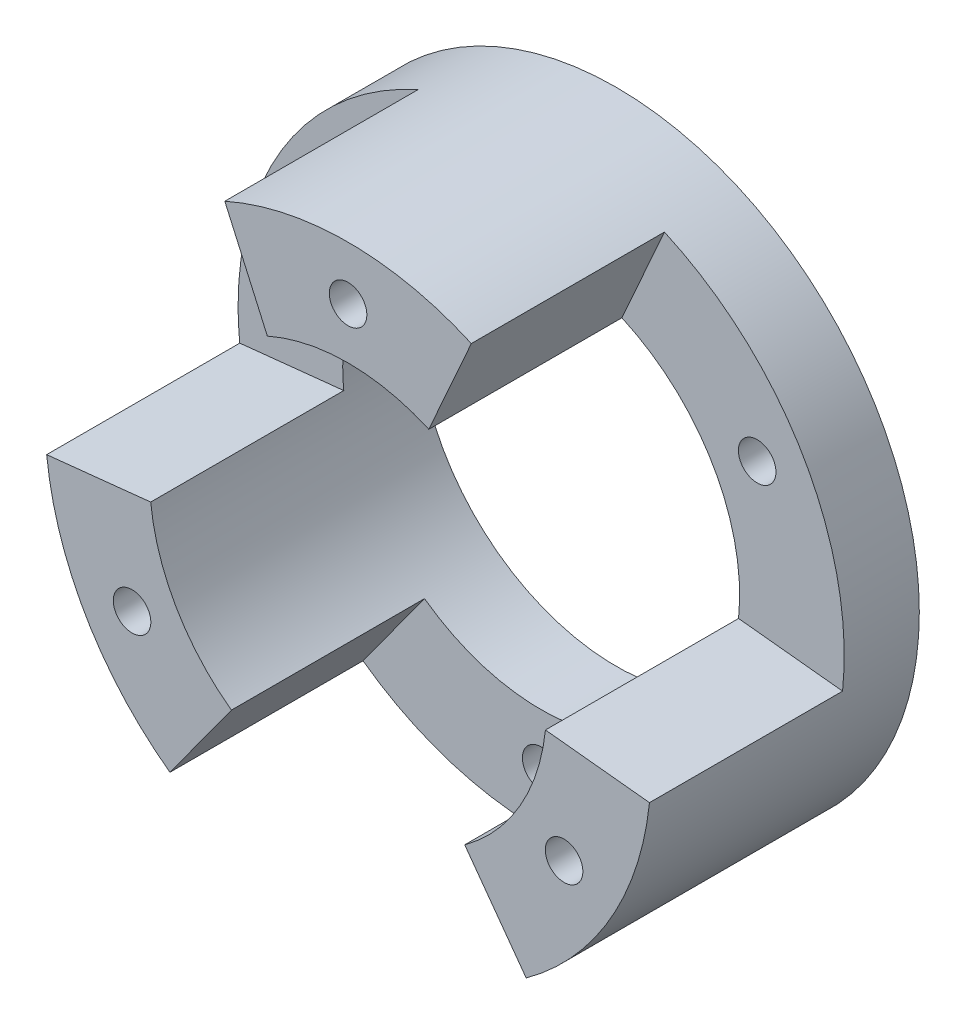
from build123d import *
from build123d.topology import SkipClean

# Parameters (mm, degrees)
BOSS_EXTRUDE1_DEPTH = 18
CIRPATTERN1_COUNT   = 3
SKETCH4_R           = 1.75
CUT_EXTRUDE1_DEPTH  = 12
CIRPATTERN2_COUNT   = 3
SKETCH5_R           = 1.75
CUT_EXTRUDE2_DEPTH  = 44.819230938
CIRPATTERN3_COUNT   = 3


with BuildPart() as part:
    # Sketch2 → Revolve1 (revolve)
    with BuildSketch(Plane(origin=(0, 0, 0), x_dir=(0, 0, -1), z_dir=(1, 0, 0))):
        Polygon((0, 28.25), (-3, 28.25), (-3, 18.5), (0, 18.5), (4, 18.5), (4, 28.25), align=None)
    revolve(axis=Axis((0, 0, 0), (0, 0, 1)))

    # Sketch3 → Boss-Extrude1 (add)
    with BuildSketch(Plane.XY.offset(3)):
        with BuildLine():
            Line((-7.524627897, 16.900590966), (-11.490310167, 25.807659178))
            ThreePointArc((-11.490310167, 25.807659178), (0, 28.25), (11.490310167, 25.807659178))
            Line((11.490310167, 25.807659178), (7.524627897, 16.900590966))
            ThreePointArc((7.524627897, 16.900590966), (0, 18.5), (-7.524627897, 16.900590966))
        make_face()
    boss_extrude1 = extrude(amount=BOSS_EXTRUDE1_DEPTH)

    # CirPattern1: Boss-Extrude1 ×3 about axis
    with SkipClean():  # the faces are left unmerged after this step: merging them gives an invalid solid
        cirpattern1_axis = Axis((0, 0, 3), (0, 0, -1))
        for i in range(1, CIRPATTERN1_COUNT):
            add(boss_extrude1.rotate(cirpattern1_axis, i * 360 / CIRPATTERN1_COUNT))

    # Sketch4 → Cut-Extrude1 (cut)
    with SkipClean():  # the faces are left unmerged after this step: merging them gives an invalid solid
        with BuildSketch(Plane.XY.offset(21)):
            with Locations((0, 23.25)):
                Circle(SKETCH4_R)
        cut_extrude1 = extrude(amount=-CUT_EXTRUDE1_DEPTH, mode=Mode.SUBTRACT)

    # CirPattern2: Cut-Extrude1 ×3 about axis
    with SkipClean():  # the faces are left unmerged after this step: merging them gives an invalid solid
        cirpattern2_axis = Axis((0, 0, -4), (0, 0, -1))
        for i in range(1, CIRPATTERN2_COUNT):
            add(cut_extrude1.rotate(cirpattern2_axis, i * 360 / CIRPATTERN2_COUNT), mode=Mode.SUBTRACT)

    # Sketch5 → Cut-Extrude2 (cut, through all)
    with SkipClean():  # the faces are left unmerged after this step: merging them gives an invalid solid
        with BuildSketch(Plane.XY.offset(3)):
            with Locations((0, -23.25)):
                Circle(SKETCH5_R)
        cut_extrude2 = extrude(amount=-CUT_EXTRUDE2_DEPTH, mode=Mode.SUBTRACT)

    # CirPattern3: Cut-Extrude2 ×3 about axis
    with SkipClean():  # the faces are left unmerged after this step: merging them gives an invalid solid
        cirpattern3_axis = Axis((0, 0, -4), (0, 0, -1))
        for i in range(1, CIRPATTERN3_COUNT):
            add(cut_extrude2.rotate(cirpattern3_axis, i * 360 / CIRPATTERN3_COUNT), mode=Mode.SUBTRACT)


solid = part.part
